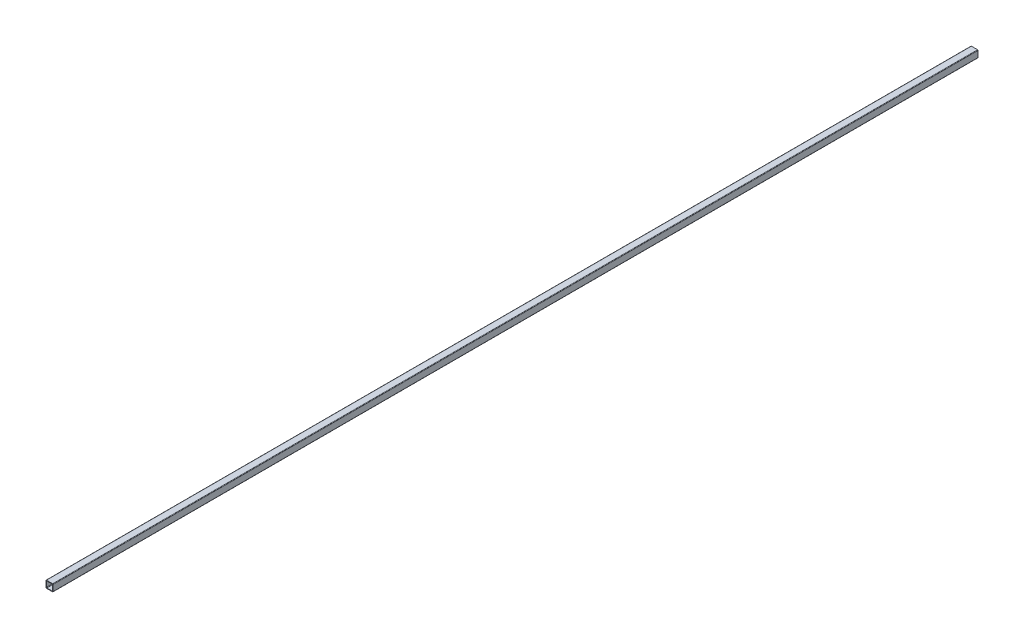
from build123d import *

# Parameters (mm, degrees)
BOSS_EXTRUDE1_DEPTH = 5000


with BuildPart() as part:
    # Sketch1 → Boss-Extrude1 (new body)
    with BuildSketch(Plane.XY):
        with BuildLine():
            Line((2.54, 0), (35.56, 0))
            ThreePointArc((35.56, 0), (37.356051224, -0.743948776), (38.1, -2.54))
            Line((38.1, -2.54), (38.1, -35.56))
            ThreePointArc((38.1, -35.56), (37.356051224, -37.356051224), (35.56, -38.1))
            Line((35.56, -38.1), (2.54, -38.1))
            ThreePointArc((2.54, -38.1), (0.743948776, -37.356051224), (0, -35.56))
            Line((0, -35.56), (0, -2.54))
            ThreePointArc((0, -2.54), (0.743948776, -0.743948776), (2.54, 0))
        make_face()
        with BuildLine():
            Line((5.3086, -2.7686), (32.7914, -2.7686))
            ThreePointArc((32.7914, -2.7686), (34.587451224, -3.512548776), (35.3314, -5.3086))
            Line((35.3314, -5.3086), (35.3314, -32.7914))
            ThreePointArc((35.3314, -32.7914), (34.587451224, -34.587451224), (32.7914, -35.3314))
            Line((32.7914, -35.3314), (5.3086, -35.3314))
            ThreePointArc((5.3086, -35.3314), (3.512548776, -34.587451224), (2.7686, -32.7914))
            Line((2.7686, -32.7914), (2.7686, -5.3086))
            ThreePointArc((2.7686, -5.3086), (3.512548776, -3.512548776), (5.3086, -2.7686))
        make_face(mode=Mode.SUBTRACT)
    extrude(amount=BOSS_EXTRUDE1_DEPTH)


solid = part.part
